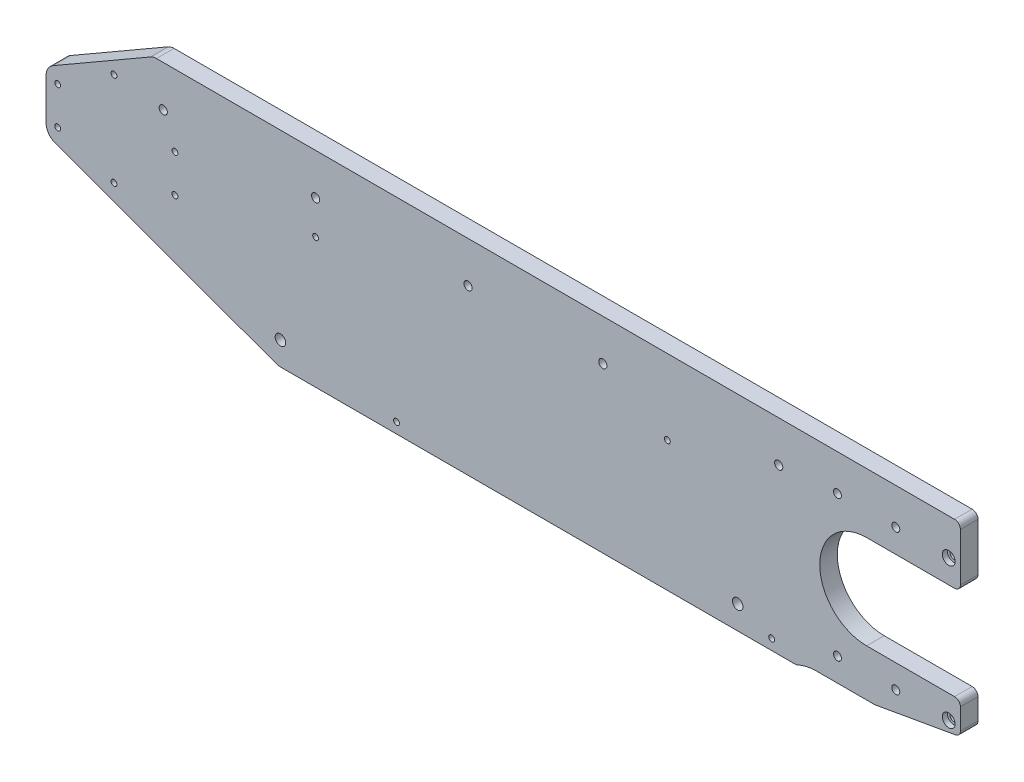
from build123d import *

# Parameters (mm, degrees)
SKIZZE1_R                                            = 2.5
AUFSATZ_LINEAR_AUSTRAGEN1_DEPTH                      = 7.5
M6_GEWINDEBOHRUNG1_D                                 = 5
M8_GEWINDEBOHRUNG1_D                                 = 6.8
DURCHGANGSLOCH_F_R_M81_D                             = 9
F_5_0_5_DURCHMESSER_BOHRUNG1_D                       = 5
STIRNSENKUNG_F_R_M6_ZYLINDERSCHRAUBE_MIT_D           = 6.6
STIRNSENKUNG_F_R_M6_ZYLINDERSCHRAUBE_MIT_CBORE_D     = 11
STIRNSENKUNG_F_R_M6_ZYLINDERSCHRAUBE_MIT_CBORE_DEPTH = 4.4
F_7_0_7_DURCHMESSER_BOHRUNG2_D                       = 7
M6_GEWINDEBOHRUNG2_D                                 = 5


with BuildPart() as part:
    # Skizze1 → Aufsatz-Linear austragen1 (new, symmetric)
    with BuildSketch(Plane.XY):
        with BuildLine():
            Line((0, 40), (75, 40))
            ThreePointArc((75, 40), (78.535533906, 41.464466094), (80, 45))
            Line((80, 45), (80, 86))
            ThreePointArc((80, 86), (78.535533906, 89.535533906), (75, 91))
            Line((75, 91), (-605.785553141, 91))
            ThreePointArc((-605.785553141, 91), (-608.373743593, 90.659258263), (-610.785553141, 89.660254038))
            Line((-610.785553141, 89.660254038), (-694, 41.616370744))
            ThreePointArc((-694, 41.616370744), (-698.392304845, 37.224065898), (-700, 31.224065898))
            Line((-700, 31.224065898), (-700, -3.445240413))
            ThreePointArc((-700, -3.445240413), (-697.829824531, -10.328157649), (-692.10424172, -14.721551862))
            Line((-692.10424172, -14.721551862), (-503.420201433, -83.396926208))
            ThreePointArc((-503.420201433, -83.396926208), (-501.736481777, -83.84807753), (-500, -84))
            Line((-500, -84), (-61.111641217, -84))
            ThreePointArc((-61.111641217, -84), (-60.057548663, -83.8876261), (-59.050837107, -83.555555556))
            ThreePointArc((-59.050837107, -83.555555556), (-50.997144653, -80.898991204), (-42.564404226, -80))
            Line((-42.564404226, -80), (6.561649764, -80))
            ThreePointArc((6.561649764, -80), (6.997428478, -79.98097349), (7.429890653, -79.924038765))
            Line((7.429890653, -79.924038765), (75.868240888, -67.856511103))
            ThreePointArc((75.868240888, -67.856511103), (78.830222216, -66.146410387), (80, -62.932472338))
            Line((80, -62.932472338), (80, -45))
            ThreePointArc((80, -45), (78.535533906, -41.464466094), (75, -40))
            Line((75, -40), (0, -40))
            ThreePointArc((0, -40), (-40, 0), (0, 40))
        make_face()
        with Locations((-690, 30)):
            Circle(SKIZZE1_R, mode=Mode.SUBTRACT)
        with Locations((-590, -2)):
            Circle(SKIZZE1_R, mode=Mode.SUBTRACT)
    extrude(amount=AUFSATZ_LINEAR_AUSTRAGEN1_DEPTH, both=True)

    # M6 Gewindebohrung1 (through all)
    with Locations(Plane.XY.offset(7.5)):
        with Locations((-590, 30), (-690, -2), (-642, 61), (-642, -19)):
            Hole(M6_GEWINDEBOHRUNG1_D / 2)

    # M8 Gewindebohrung1 (through all)
    with Locations(Plane.XY.offset(7.5)):
        with Locations((-24.874423104, -60.052169613), (-24.874423104, 60.052169613), (24.874423104, 60.052169613), (24.874423104, -60.052169613)):
            Hole(M8_GEWINDEBOHRUNG1_D / 2)

    # Durchgangsloch für M81 (through all)
    with Locations(Plane.XY.offset(7.5)):
        with Locations((-500, -64), (-110, -64)):
            Hole(DURCHGANGSLOCH_F_R_M81_D / 2)

    # Ø5.0 (5) Durchmesser Bohrung1 (through all)
    with Locations(Plane.XY.offset(7.5)):
        with Locations((-170, 27), (-470, 27)):
            Hole(F_5_0_5_DURCHMESSER_BOHRUNG1_D / 2)

    # Stirnsenkung für M6 Zylinderschraube mit Innensechskant1 (through all)
    with Locations(Plane.XY.offset(7.5)):
        with Locations((70, 60), (70, -60)):
            stirnsenkung_f_r_m6_zylinderschraube_mit = CounterBoreHole(STIRNSENKUNG_F_R_M6_ZYLINDERSCHRAUBE_MIT_D / 2, STIRNSENKUNG_F_R_M6_ZYLINDERSCHRAUBE_MIT_CBORE_D / 2, STIRNSENKUNG_F_R_M6_ZYLINDERSCHRAUBE_MIT_CBORE_DEPTH)

    # Spiegeln1: Stirnsenkung für M6 Zylinderschraube mit Innensechskant1 across plane
    add(stirnsenkung_f_r_m6_zylinderschraube_mit.mirror(Plane.XY), mode=Mode.SUBTRACT)

    # Ø7.0 (7) Durchmesser Bohrung2 (through all)
    with Locations(Plane.XY.offset(7.5)):
        with Locations((-75, 56), (-225, 56), (-340, 56), (-470, 56), (-600, 56)):
            Hole(F_7_0_7_DURCHMESSER_BOHRUNG2_D / 2)

    # M6 Gewindebohrung2 (through all)
    with Locations(Plane(origin=(0, 0, -7.5), x_dir=(-1, 0, 0), z_dir=(0, 0, -1))):
        with Locations((81, -75), (401, -75)):
            Hole(M6_GEWINDEBOHRUNG2_D / 2)


solid = part.part
